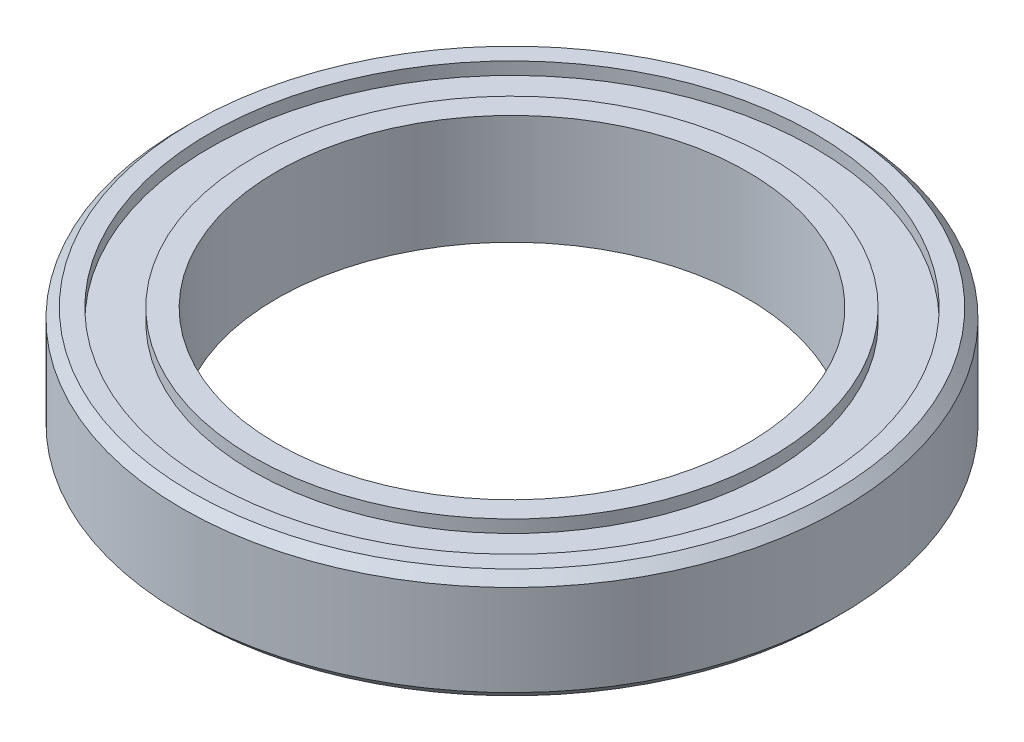
from build123d import *

# Parameters (mm, degrees)
SKETCH_1_R          = 21
SKETCH_1_R_2        = 15
EXTRUDE_1_DEPTH     = 7
CHAMFER_1_SIZE      = 0.6
SKETCH_2_R          = 19.25
SKETCH_2_R_2        = 16.5
CUT_EXTRUDE_1_DEPTH = 0.8
CUT_EXTRUDE_START   = -0.8
SKETCH_3_R          = 19.25
SKETCH_3_R_2        = 16.5
CUT_EXTRUDE_3_DEPTH = 0.8


with BuildPart() as part:
    # 草图1 → 凸台-拉伸1 (new body)
    with BuildSketch(Plane(origin=(0, 0, 0), x_dir=(1, 0, 0), z_dir=(0, 1, 0))):
        with Locations(Location((0, 0, 0), (0, 0, 270))):
            Circle(SKETCH_1_R)
        with Locations(Location((0, 0, 0), (0, 0, 270))):
            Circle(SKETCH_1_R_2, mode=Mode.SUBTRACT)
    extrude(amount=EXTRUDE_1_DEPTH)

    # 倒角1
    chamfer_1_edges = [part.edges().sort_by_distance(p)[0] for p in [
        (0, 0, -21),
        (0, 7, -21),
    ]]
    chamfer(chamfer_1_edges, length=CHAMFER_1_SIZE)

    # 草图2 → 切除-拉伸1 (cut)
    with BuildSketch(Plane(origin=(0, 7, 0), x_dir=(1, 0, 0), z_dir=(0, 1, 0))):
        with Locations(Location((0, 0, 0), (0, 0, 270))):
            Circle(SKETCH_2_R)
        with Locations(Location((0, 0, 0), (0, 0, 270))):
            Circle(SKETCH_2_R_2, mode=Mode.SUBTRACT)
    extrude(amount=-CUT_EXTRUDE_1_DEPTH, mode=Mode.SUBTRACT)

    # 草图3 → 切除-拉伸3 (cut)
    with BuildSketch(Plane.XZ.offset(CUT_EXTRUDE_START)):
        with Locations(Location((0, 0, 0), (0, 0, 90))):
            Circle(SKETCH_3_R)
        with Locations(Location((0, 0, 0), (0, 0, 90))):
            Circle(SKETCH_3_R_2, mode=Mode.SUBTRACT)
    extrude(amount=CUT_EXTRUDE_3_DEPTH, mode=Mode.SUBTRACT)


solid = part.part
